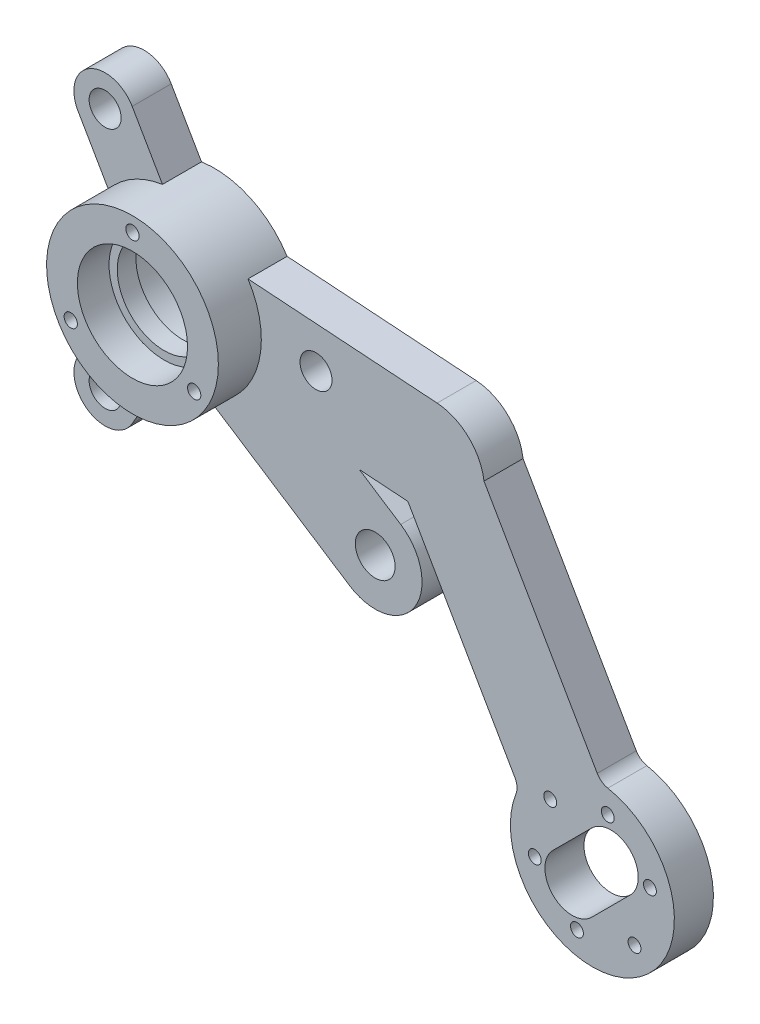
from build123d import *

# Parameters (mm, degrees)
S01_BEARING_BARREL_R                             = 22
F_01_BEARING_BARREL_DEPTH                        = 21
F_02_TORQUE_ARM_1_DEPTH                          = 10
F_03_TORQUE_ARM_2_DEPTH                          = 10
F_04_TORQUE_ARM_3_DEPTH                          = 10
F_05_WHEEL_ARM_ROOT_TO_ROUNDED_ELBOW_DEPTH       = 10
F_06_LONG_DROPPED_WHEEL_ARM_DEPTH                = 10
F_07_BROAD_CAM_FOLLOWER_MOUNTING_LUG_DEPTH       = 10
F_08_START                                       = -1
S08_BEARING_THROUGH_RELIEF_R                     = 12
F_08_BEARING_THROUGH_RELIEF_DEPTH                = 23
F_09_START                                       = -0.1
S09_INBOARD_6001_SEAT_R                          = 14.1
F_09_INBOARD_6001_SEAT_DEPTH                     = 8.2
F_10_START                                       = 12.9
S10_OUTBOARD_6001_SEAT_R                         = 14.1
F_10_OUTBOARD_6001_SEAT_DEPTH                    = 8.2
F_11_START                                       = -1
S11_KEEPER_SCREWS_R                              = 1.7
F_11_KEEPER_SCREWS_DEPTH                         = 23
F_12_START                                       = -1
S12_TORQUE_PIN_RETAINING_STEMS_R                 = 3.25
F_12_TORQUE_PIN_RETAINING_STEMS_DEPTH            = 12
F_19_START                                       = -1
S19_THROUGH_BORE_FOR_STEEL_FOLLOWER_BU_R         = 5.1
F_19_THROUGH_BORE_FOR_STEEL_FOLLOWER_BUS_DEPTH   = 12
F_20_START                                       = -0.1
S20_FLUSH_SEAT_FOR_BUSH_FLANGE_R                 = 7.6
F_20_FLUSH_SEAT_FOR_BUSH_FLANGE_DEPTH            = 2.1
FLAT_MOTOR_MOUNTING_PAD_LAYOUT_R                 = 21
FLAT_MOTOR_MOUNTING_PAD_DEPTH                    = 10
R4_BLENDS_FROM_ARM_INTO_MOTOR_PAD_R              = 4
F_28_START                                       = 10.12
F_28_X_14_CLOSED_THROUGH_SLOT_FOR_MOTOR_OU_DEPTH = 10.24
SIX_START                                        = 10.12
SIX_CLEARANCE_HOLES_FROM_JOHNSON_MOT_2_R         = 1.65
SIX_CLEARANCE_HOLES_FROM_JOHNSON_MOTOR_F_DEPTH   = 10.24
F_01_START                                       = -0.1
S01_PRINTED_DRIVE_PIN_PILOT_BORES_R              = 4.1
F_01_PRINTED_DRIVE_PIN_PILOT_BORES_DEPTH         = 10.2
F_02_START                                       = -0.1
S02_FLUSH_SEATS_FOR_DRIVE_PIN_SHOULDER_R         = 5.4
F_02_FLUSH_SEATS_FOR_DRIVE_PIN_SHOULDERS_DEPTH   = 2.1


with BuildPart() as part:
    # S01 - Bearing barrel → 01 - Bearing barrel (new body)
    with BuildSketch(Plane.XY):
        Circle(S01_BEARING_BARREL_R)
    extrude(amount=F_01_BEARING_BARREL_DEPTH)

    # S02 - Torque arm 1 → 02 - Torque arm 1 (add)
    with BuildSketch(Plane.XY):
        with BuildLine():
            Line((0, 8), (36, 8))
            ThreePointArc((36, 8), (44, 0), (36, -8))
            Line((36, -8), (0, -8))
            ThreePointArc((0, -8), (-8, 0), (0, 8))
        make_face()
    extrude(amount=F_02_TORQUE_ARM_1_DEPTH)

    # S03 - Torque arm 2 → 03 - Torque arm 2 (add)
    with BuildSketch(Plane.XY):
        with BuildLine():
            Line((-6.92820323, -4), (-24.92820323, 27.176914536))
            ThreePointArc((-24.92820323, 27.176914536), (-22, 38.105117767), (-11.07179677, 35.176914536))
            Line((-11.07179677, 35.176914536), (6.92820323, 4))
            ThreePointArc((6.92820323, 4), (4, -6.92820323), (-6.92820323, -4))
        make_face()
    extrude(amount=F_03_TORQUE_ARM_2_DEPTH)

    # S04 - Torque arm 3 → 04 - Torque arm 3 (add)
    with BuildSketch(Plane.XY):
        with BuildLine():
            Line((6.92820323, -4), (-11.07179677, -35.176914536))
            ThreePointArc((-11.07179677, -35.176914536), (-22, -38.105117767), (-24.92820323, -27.176914536))
            Line((-24.92820323, -27.176914536), (-6.92820323, 4))
            ThreePointArc((-6.92820323, 4), (4, 6.92820323), (6.92820323, -4))
        make_face()
    extrude(amount=F_04_TORQUE_ARM_3_DEPTH)

    # S05 - Wheel arm root to rounded elbow → 05 - Wheel arm root to rounded elbow (add)
    with BuildSketch(Plane.XY):
        with BuildLine():
            Line((0.890943823, 12.969434032), (67.022341031, 8.426494092))
            ThreePointArc((67.022341031, 8.426494092), (79.10083124, -5.433883763), (65.240453385, -17.512373972))
            Line((65.240453385, -17.512373972), (-0.890943823, -12.969434032))
            ThreePointArc((-0.890943823, -12.969434032), (-12.969434032, 0.890943823), (0.890943823, 12.969434032))
        make_face()
    extrude(amount=F_05_WHEEL_ARM_ROOT_TO_ROUNDED_ELBOW_DEPTH)

    # S06 - Long dropped wheel arm → 06 - Long dropped wheel arm (add)
    with BuildSketch(Plane.XY):
        with BuildLine():
            Line((76.528125799, 1.449391376), (116.886494349, -68.572605409))
            ThreePointArc((116.886494349, -68.572605409), (112.482097074, -84.961665317), (96.093037167, -80.557268042))
            Line((96.093037167, -80.557268042), (55.734668617, -10.535271257))
            ThreePointArc((55.734668617, -10.535271257), (60.139065892, 5.853788651), (76.528125799, 1.449391376))
        make_face()
    extrude(amount=F_06_LONG_DROPPED_WHEEL_ARM_DEPTH)

    # S07 - Broad cam follower mounting lug → 07 - Broad cam follower mounting lug (add)
    with BuildSketch(Plane.XY):
        with BuildLine():
            Line((6.53566842, 10.064046815), (57.694573065, -23.158934321))
            ThreePointArc((57.694573065, -23.158934321), (61.22295146, -39.758649556), (44.623236224, -43.287027951))
            Line((44.623236224, -43.287027951), (-6.53566842, -10.064046815))
            ThreePointArc((-6.53566842, -10.064046815), (-10.064046815, 6.53566842), (6.53566842, 10.064046815))
        make_face()
    extrude(amount=F_07_BROAD_CAM_FOLLOWER_MOUNTING_LUG_DEPTH)

    # S08 - Bearing through relief → 08 - Bearing through relief (cut)
    with BuildSketch(Plane.XY.offset(F_08_START)):
        Circle(S08_BEARING_THROUGH_RELIEF_R)
    extrude(amount=F_08_BEARING_THROUGH_RELIEF_DEPTH, mode=Mode.SUBTRACT)

    # S09 - Inboard 6001 seat → 09 - Inboard 6001 seat (cut)
    with BuildSketch(Plane.XY.offset(F_09_START)):
        Circle(S09_INBOARD_6001_SEAT_R)
    extrude(amount=F_09_INBOARD_6001_SEAT_DEPTH, mode=Mode.SUBTRACT)

    # S10 - Outboard 6001 seat → 10 - Outboard 6001 seat (cut)
    with BuildSketch(Plane.XY.offset(F_10_START)):
        Circle(S10_OUTBOARD_6001_SEAT_R)
    extrude(amount=F_10_OUTBOARD_6001_SEAT_DEPTH, mode=Mode.SUBTRACT)

    # S11 - Keeper screws → 11 - Keeper screws (cut)
    with BuildSketch(Plane.XY.offset(F_11_START)):
        with Locations((0, 18.25)):
            Circle(S11_KEEPER_SCREWS_R)
        with Locations((-15.804963619, -9.125)):
            Circle(S11_KEEPER_SCREWS_R)
        with Locations((15.804963619, -9.125)):
            Circle(S11_KEEPER_SCREWS_R)
    extrude(amount=F_11_KEEPER_SCREWS_DEPTH, mode=Mode.SUBTRACT)

    # S12 - Torque pin retaining stems → 12 - Torque pin retaining stems (cut)
    with BuildSketch(Plane.XY.offset(F_12_START)):
        with Locations((36, 0)):
            Circle(S12_TORQUE_PIN_RETAINING_STEMS_R)
        with Locations((-18, 31.176914536)):
            Circle(S12_TORQUE_PIN_RETAINING_STEMS_R)
        with Locations((-18, -31.176914536)):
            Circle(S12_TORQUE_PIN_RETAINING_STEMS_R)
    extrude(amount=F_12_TORQUE_PIN_RETAINING_STEMS_DEPTH, mode=Mode.SUBTRACT)

    # S19 - Through bore for steel follower bush → 19 - Through bore for steel follower bush (cut)
    with BuildSketch(Plane.XY.offset(F_19_START)):
        with Locations((51.158904645, -33.222981136)):
            Circle(S19_THROUGH_BORE_FOR_STEEL_FOLLOWER_BU_R)
    extrude(amount=F_19_THROUGH_BORE_FOR_STEEL_FOLLOWER_BUS_DEPTH, mode=Mode.SUBTRACT)

    # S20 - Flush seat for bush flange → 20 - Flush seat for bush flange (cut)
    with BuildSketch(Plane.XY.offset(F_20_START)):
        with Locations((51.158904645, -33.222981136)):
            Circle(S20_FLUSH_SEAT_FOR_BUSH_FLANGE_R)
    extrude(amount=F_20_FLUSH_SEAT_FOR_BUSH_FLANGE_DEPTH, mode=Mode.SUBTRACT)

    # Flat motor mounting pad layout → Flat motor mounting pad (add)
    with BuildSketch(Plane.XY):
        with Locations((106.780015642, -75.748703358)):
            Circle(FLAT_MOTOR_MOUNTING_PAD_LAYOUT_R)
    extrude(amount=FLAT_MOTOR_MOUNTING_PAD_DEPTH)

    # R4 blends from arm into motor pad
    r4_blends_from_arm_into_motor_pad_edges = [part.edges().sort_by_distance(p)[0] for p in [
        (87.956079001, -66.439599786, 5),
        (108.985808176, -54.864870393, 5),
    ]]
    fillet(r4_blends_from_arm_into_motor_pad_edges, radius=R4_BLENDS_FROM_ARM_INTO_MOTOR_PAD_R)

    # Original round-ended output slot layout → 28 x 14 closed through slot for motor output (cut)
    with BuildSketch(Plane.XY.offset(F_28_START)):
        with BuildLine():
            Line((96.668388671, -75.960835392), (106.567883608, -66.061340455))
            ThreePointArc((106.567883608, -66.061340455), (116.467378544, -66.061340455), (116.467378544, -75.960835392))
            Line((116.467378544, -75.960835392), (106.567883608, -85.860330328))
            ThreePointArc((106.567883608, -85.860330328), (96.668388671, -85.860330328), (96.668388671, -75.960835392))
        make_face()
    extrude(amount=-F_28_X_14_CLOSED_THROUGH_SLOT_FOR_MOTOR_OU_DEPTH, mode=Mode.SUBTRACT)

    # Six clearance holes from Johnson mot 2 → Six clearance holes from Johnson motor f (cut)
    with BuildSketch(Plane.XY.offset(SIX_START)):
        with Locations((92.035157904, -79.699576081)):
            Circle(SIX_CLEARANCE_HOLES_FROM_JOHNSON_MOT_2_R)
        with Locations((102.829142919, -90.493561096)):
            Circle(SIX_CLEARANCE_HOLES_FROM_JOHNSON_MOT_2_R)
        with Locations((117.574000657, -86.542688372)):
            Circle(SIX_CLEARANCE_HOLES_FROM_JOHNSON_MOT_2_R)
        with Locations((121.52487338, -71.797830634)):
            Circle(SIX_CLEARANCE_HOLES_FROM_JOHNSON_MOT_2_R)
        with Locations((110.730888366, -61.003845619)):
            Circle(SIX_CLEARANCE_HOLES_FROM_JOHNSON_MOT_2_R)
        with Locations((95.986030627, -64.954718343)):
            Circle(SIX_CLEARANCE_HOLES_FROM_JOHNSON_MOT_2_R)
    extrude(amount=-SIX_CLEARANCE_HOLES_FROM_JOHNSON_MOTOR_F_DEPTH, mode=Mode.SUBTRACT)

    # S01 - Printed drive pin pilot bores → 01 - Printed drive pin pilot bores (cut)
    with BuildSketch(Plane.XY.offset(F_01_START)):
        with Locations((36, 0)):
            Circle(S01_PRINTED_DRIVE_PIN_PILOT_BORES_R)
        with Locations((-18, 31.176914536)):
            Circle(S01_PRINTED_DRIVE_PIN_PILOT_BORES_R)
        with Locations((-18, -31.176914536)):
            Circle(S01_PRINTED_DRIVE_PIN_PILOT_BORES_R)
    extrude(amount=F_01_PRINTED_DRIVE_PIN_PILOT_BORES_DEPTH, mode=Mode.SUBTRACT)

    # S02 - Flush seats for drive pin shoulders → 02 - Flush seats for drive pin shoulders (cut)
    with BuildSketch(Plane.XY.offset(F_02_START)):
        with Locations((36, 0)):
            Circle(S02_FLUSH_SEATS_FOR_DRIVE_PIN_SHOULDER_R)
        with Locations((-18, 31.176914536)):
            Circle(S02_FLUSH_SEATS_FOR_DRIVE_PIN_SHOULDER_R)
        with Locations((-18, -31.176914536)):
            Circle(S02_FLUSH_SEATS_FOR_DRIVE_PIN_SHOULDER_R)
    extrude(amount=F_02_FLUSH_SEATS_FOR_DRIVE_PIN_SHOULDERS_DEPTH, mode=Mode.SUBTRACT)


solid = part.part
